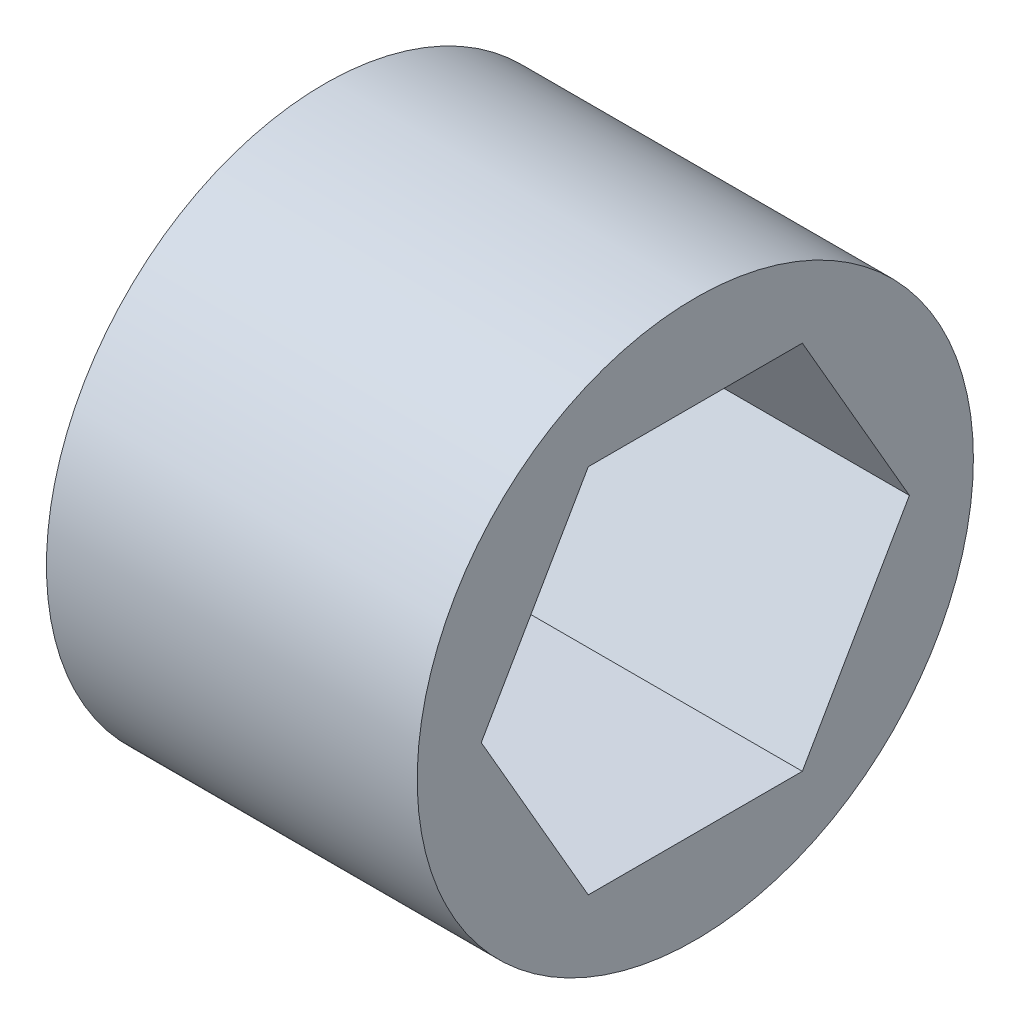
from build123d import *

# Parameters (mm, degrees)
SKETCH1_R           = 9.525
BOSS_EXTRUDE1_DEPTH = 12.7


with BuildPart() as part:
    # Sketch1 → Boss-Extrude1 (new body)
    with BuildSketch(Plane(origin=(0, 0, 0), x_dir=(0, 0, -1), z_dir=(1, 0, 0))):
        Circle(SKETCH1_R)
        Polygon((-3.666174209, 6.35), (-7.332348419, 0), (-3.666174209, -6.35), (3.666174209, -6.35), (7.332348419, 0), (3.666174209, 6.35), align=None, mode=Mode.SUBTRACT)
    extrude(amount=BOSS_EXTRUDE1_DEPTH)


solid = part.part
